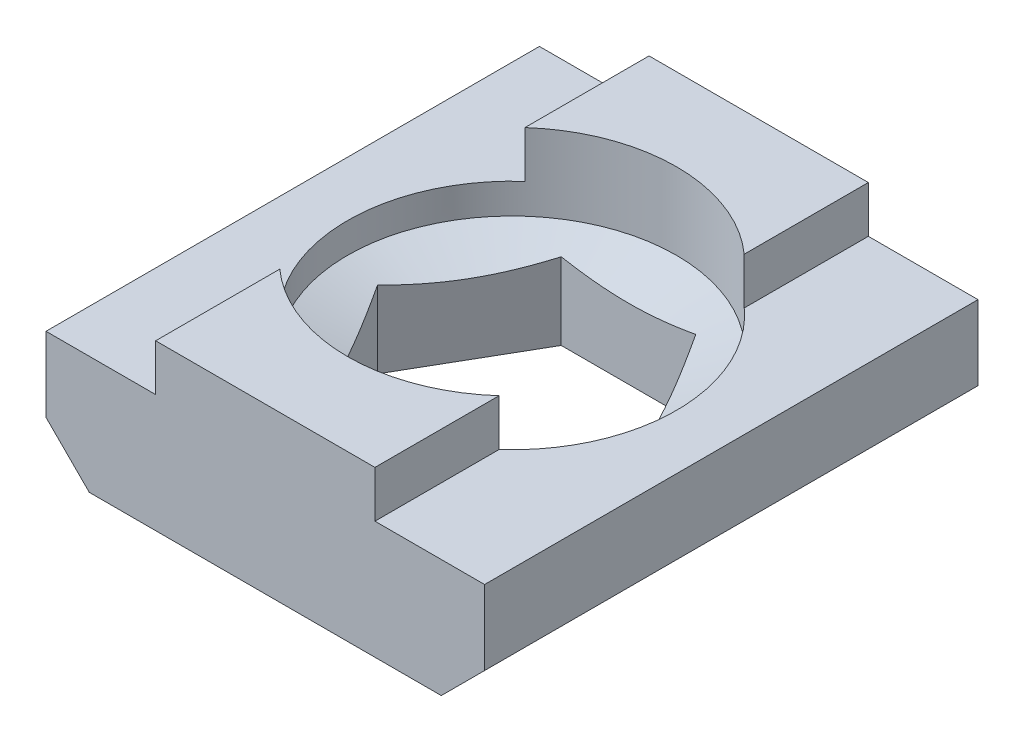
from build123d import *
from build123d.topology import SkipClean

# Parameters (mm, degrees)
SKETCH1_W           = 18
SKETCH1_H           = 6
BOSS_EXTRUDE1_DEPTH = 4
BOSS_EXTRUDE2_DEPTH = 18
SKETCH2_R           = 6
CUT_EXTRUDE1_DEPTH  = 2
CUT_EXTRUDE2_DEPTH  = 14.453624047


with BuildPart() as part:
    # Sketch1 → Boss-Extrude1 (new, symmetric)
    with BuildSketch(Plane(origin=(0, 0, 0), x_dir=(0, 0, -1), z_dir=(1, 0, 0))):
        Rectangle(SKETCH1_W, SKETCH1_H)
    extrude(amount=BOSS_EXTRUDE1_DEPTH, both=True)

    # Sketch4 → Boss-Extrude2 (add)
    with BuildSketch(Plane.XY.offset(9)):
        Polygon((-4, 1.3), (-4, -3), (-6.42, -3), (-8, -1.42), (-8, 1.3), align=None)
        Polygon((8, -1.42), (8, 1.3), (4, 1.3), (4, -3), (6.42, -3), align=None)
    extrude(amount=-BOSS_EXTRUDE2_DEPTH)

    # Sketch2 → Cut-Extrude1 (cut)
    with BuildSketch(Plane(origin=(0, 3, 0), x_dir=(1, 0, 0), z_dir=(0, 1, 0))):
        with Locations(Location((0, 0, 0), (0, 0, 270))):
            Circle(SKETCH2_R)
    extrude(amount=-CUT_EXTRUDE1_DEPTH, mode=Mode.SUBTRACT)

    # Sketch5 → Cut-Extrude2 (cut, through all)
    with BuildSketch(Plane.XZ.offset(3)):
        Polygon((-2.453738644, 4.25), (-4.907477288, 0), (-2.453738644, -4.25), (2.453738644, -4.25), (4.907477288, 0), (2.453738644, 4.25), align=None)
    extrude(amount=-CUT_EXTRUDE2_DEPTH, mode=Mode.SUBTRACT)

    # Sketch6 → Cut-Revolve1 (revolve, cut)
    with SkipClean():  # the faces are left unmerged after this step: merging them gives an invalid solid
        with BuildSketch(Plane(origin=(0, 0, 0), x_dir=(0, 0, -1), z_dir=(1, 0, 0)), mode=Mode.PRIVATE) as cut_revolve1_sk:
            Polygon((6, 0.2), (3.668255705, -0.648685517), (3.668255705, 1), (6, 1), align=None)
        revolve(cut_revolve1_sk.sketch.rotate(Axis((0, 0, 0), (0, 1, 0)), 221.810314896), axis=Axis((0, 0, 0), (0, 1, 0)), mode=Mode.SUBTRACT)


solid = part.part
